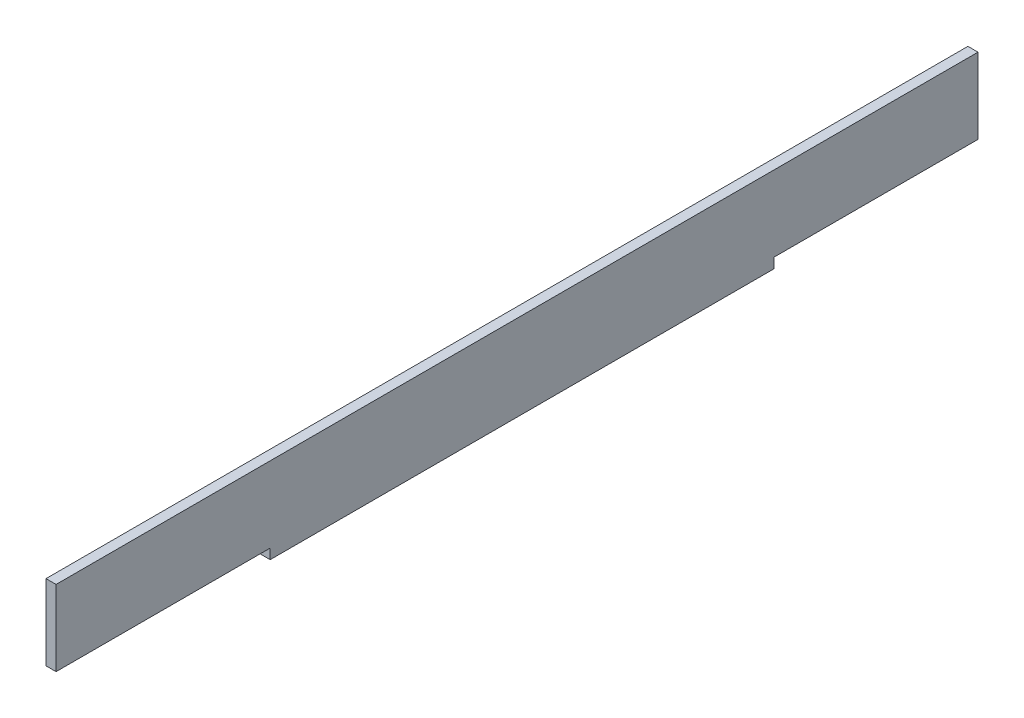
from build123d import *

# Parameters (mm, degrees)
BOSS_EXTRUDE1_DEPTH = 4


with BuildPart() as part:
    # Sketch1 → Boss-Extrude1 (new body)
    with BuildSketch(Plane(origin=(0, 0, 0), x_dir=(0, 0, -1), z_dir=(1, 0, 0))):
        Polygon((-103.80866201, -19.08748791), (96.19133799, -19.08748791), (96.19133799, -15.08748791), (177.19133799, -15.08748791), (177.19133799, 14.91251209), (96.19133799, 14.91251209), (-103.80866201, 14.91251209), (-188.80866201, 14.91251209), (-188.80866201, -15.08748791), (-103.80866201, -15.08748791), align=None)
    extrude(amount=BOSS_EXTRUDE1_DEPTH)


solid = part.part
